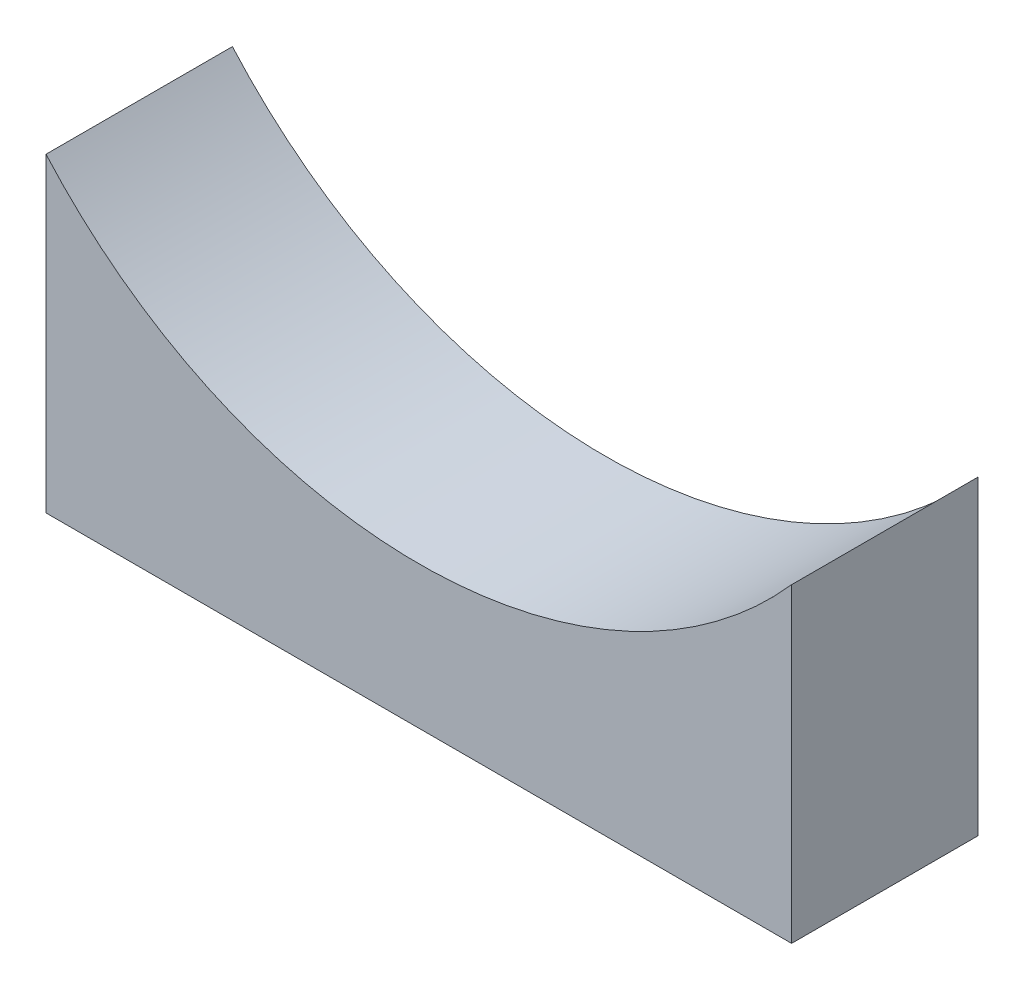
from build123d import *

# Parameters (mm, degrees)
BOSS_EXTRUDE1_DEPTH = 19.05
SKETCH2_W           = 76.2
SKETCH2_H           = 19.05
CUT_EXTRUDE1_DEPTH  = 19.05


with BuildPart() as part:
    # Sketch1 → Boss-Extrude1 (new body)
    with BuildSketch(Plane.XY):
        with BuildLine():
            Line((-38.1, 50.8), (-38.1, 0))
            Line((-38.1, 0), (38.1, 0))
            Line((38.1, 0), (38.1, 50.8))
            ThreePointArc((38.1, 50.8), (0, 33.601041651), (-38.1, 50.8))
        make_face()
    extrude(amount=BOSS_EXTRUDE1_DEPTH)

    # Sketch2 → Cut-Extrude1 (cut)
    with BuildSketch(Plane.XZ):
        with Locations((0, 9.525)):
            Rectangle(SKETCH2_W, SKETCH2_H)
    extrude(amount=-CUT_EXTRUDE1_DEPTH, mode=Mode.SUBTRACT)


solid = part.part
